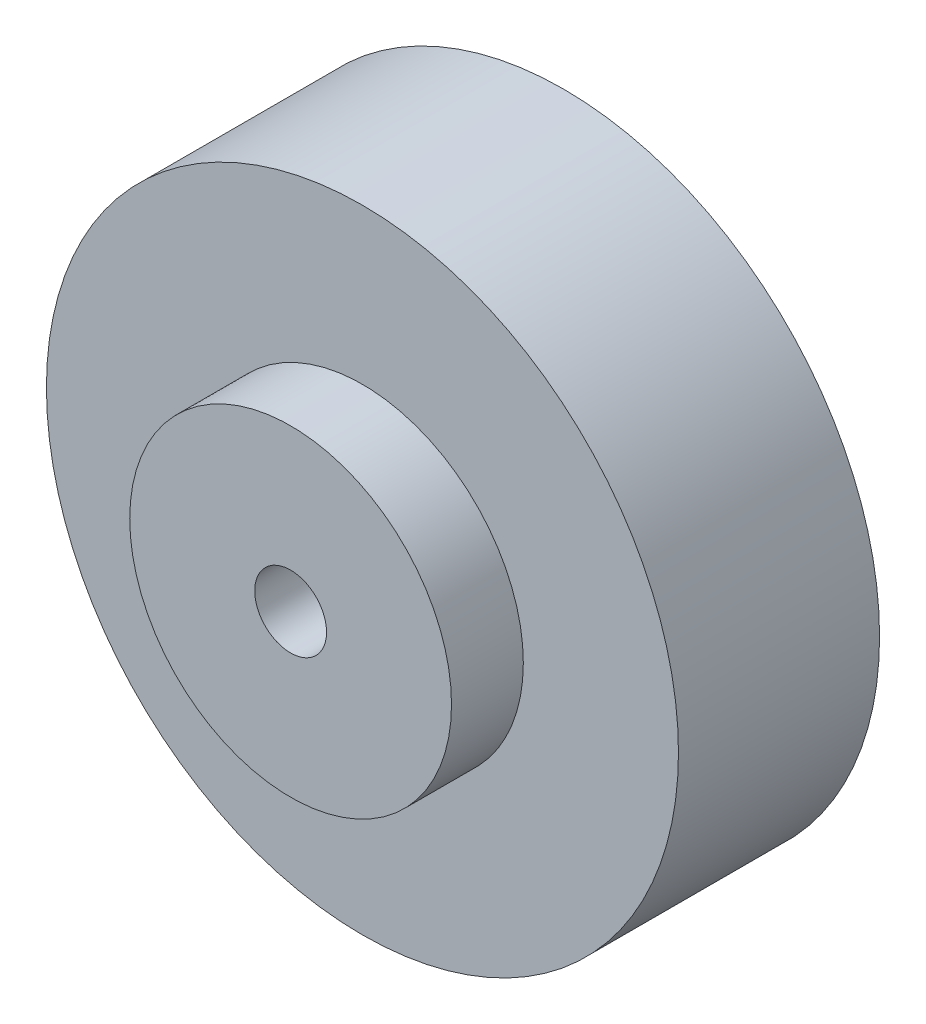
from build123d import *

# Parameters (mm, degrees)
SKETCH1_R           = 34.925
BOSS_EXTRUDE1_DEPTH = 22.225
SKETCH2_R           = 17.78
BOSS_EXTRUDE2_DEPTH = 7.9375
SKETCH3_R           = 3.96875
CUT_EXTRUDE1_DEPTH  = 30.1625


with BuildPart() as part:
    # Sketch1 → Boss-Extrude1 (new body)
    with BuildSketch(Plane.XY):
        Circle(SKETCH1_R)
    extrude(amount=BOSS_EXTRUDE1_DEPTH)

    # Sketch2 → Boss-Extrude2 (add)
    with BuildSketch(Plane.XY.offset(22.225)):
        Circle(SKETCH2_R)
    extrude(amount=BOSS_EXTRUDE2_DEPTH)

    # Sketch3 → Cut-Extrude1 (cut)
    with BuildSketch(Plane.XY.offset(30.1625)):
        Circle(SKETCH3_R)
    extrude(amount=-CUT_EXTRUDE1_DEPTH, mode=Mode.SUBTRACT)


solid = part.part
